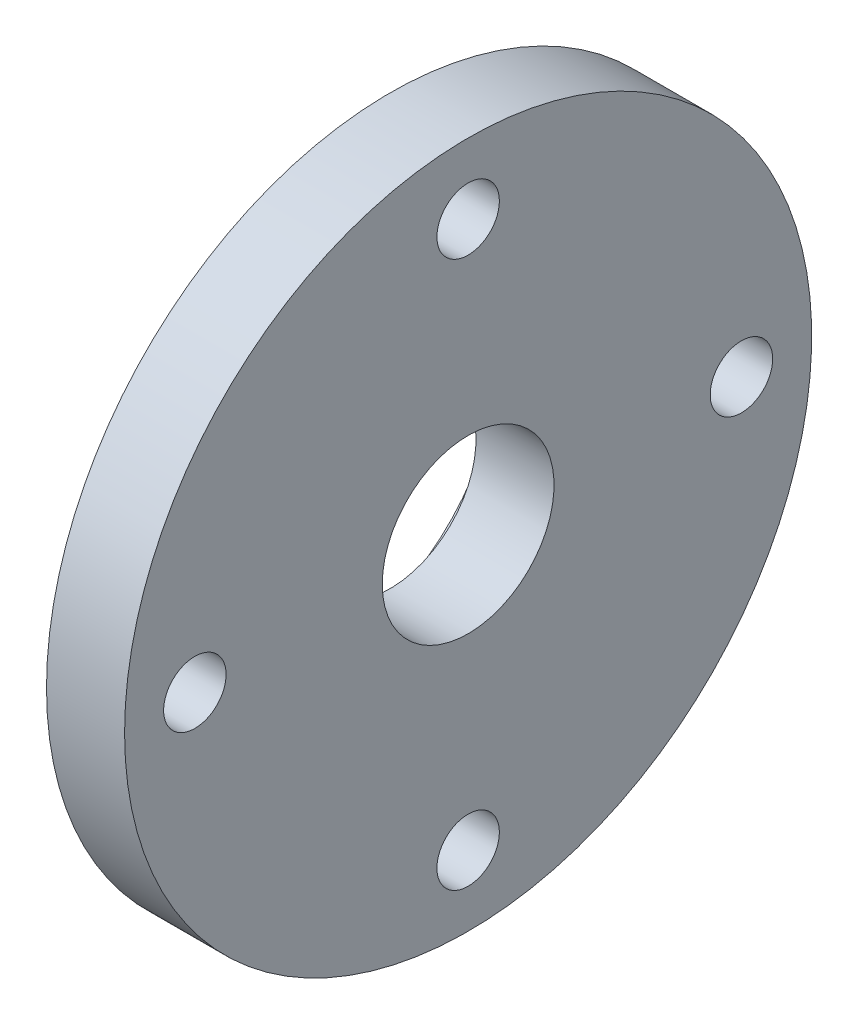
from build123d import *

# Parameters (mm, degrees)
SKETCH2_R          = 4
CUT_EXTRUDE1_DEPTH = 65.776538963


with BuildPart() as part:
    # Sketch1 → Revolve1 (revolve)
    with BuildSketch(Plane.XY, mode=Mode.PRIVATE) as revolve1_sk:
        Polygon((-13.637426901, 11), (-3.637426901, 11), (-3.637426901, 44), (-13.637426901, 44), (-13.637426901, 26), (-21.637426901, 26), (-21.637426901, 22), (-13.637426901, 22), align=None)
    revolve(revolve1_sk.sketch.rotate(Axis((-28.771929825, 0, 0), (1, 0, 0)), 90), axis=Axis((-28.771929825, 0, 0), (1, 0, 0)))

    # Sketch2 → Cut-Extrude1 (cut, through all)
    with BuildSketch(Plane(origin=(-3.637426901, 0, 0), x_dir=(0, 0, -1), z_dir=(1, 0, 0))):
        with Locations((0, 35)):
            Circle(SKETCH2_R)
        with Locations((35, 0)):
            Circle(SKETCH2_R)
        with Locations((0, -35)):
            Circle(SKETCH2_R)
        with Locations((-35, 0)):
            Circle(SKETCH2_R)
    extrude(amount=-CUT_EXTRUDE1_DEPTH, mode=Mode.SUBTRACT)


solid = part.part
